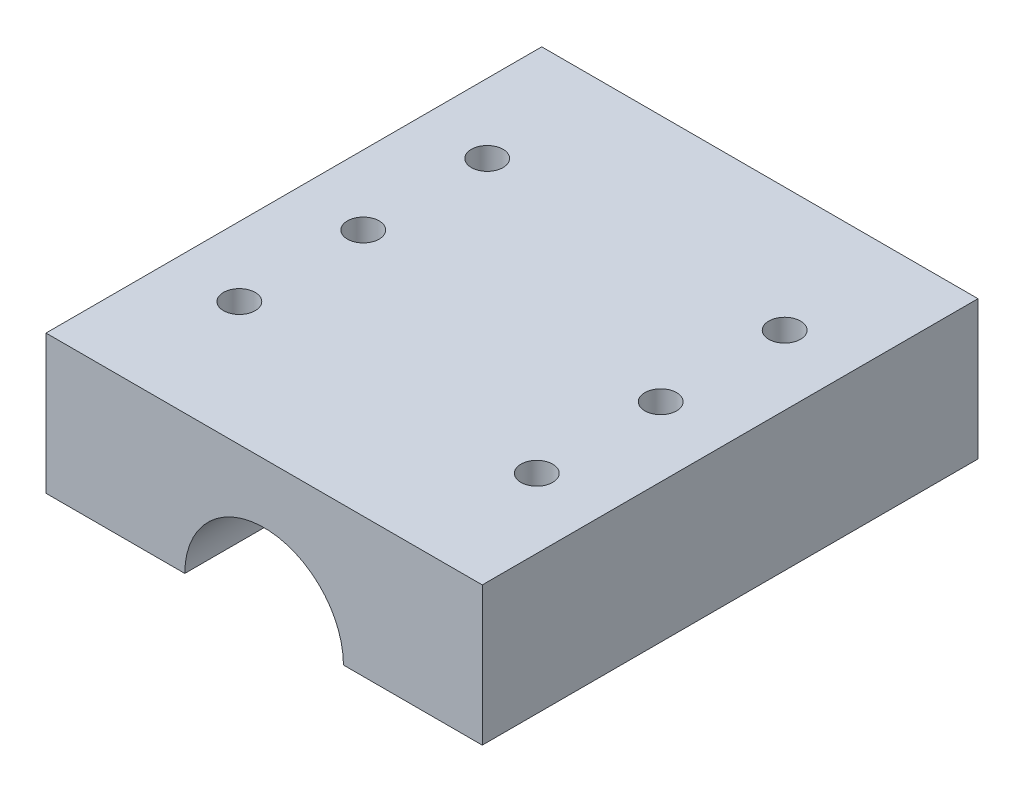
from build123d import *

# Parameters (mm, degrees)
Y_KSEKLIK_EKSTR_ZYON1_DEPTH = 50
IZIM2_R                     = 1.6
KES_EKSTR_ZYON1_DEPTH       = 57.391488719


with BuildPart() as part:
    # Çizim1 → Yükseklik-Ekstrüzyon1 (new body)
    with BuildSketch(Plane.XY):
        with BuildLine():
            Line((-8, 0), (-22, 0))
            Line((-22, 0), (-22, 14))
            Line((-22, 14), (22, 14))
            Line((22, 14), (22, 0))
            Line((22, 0), (8, 0))
            ThreePointArc((8, 0), (0, 8), (-8, 0))
        make_face()
    extrude(amount=-Y_KSEKLIK_EKSTR_ZYON1_DEPTH)

    # Çizim2 → Kes-Ekstrüzyon1 (cut, through all)
    with BuildSketch(Plane(origin=(0, 14, 0), x_dir=(1, 0, 0), z_dir=(0, 1, 0))):
        with Locations(Location((-15, 25, 0), (0, 0, 180))):
            Circle(IZIM2_R)
        with Locations(Location((-15, 37.5, 0), (0, 0, 180))):
            Circle(IZIM2_R)
        with Locations(Location((-15, 12.5, 0), (0, 0, 180))):
            Circle(IZIM2_R)
        with Locations((15, 12.5)):
            Circle(IZIM2_R)
        with Locations((15, 37.5)):
            Circle(IZIM2_R)
        with Locations((15, 25)):
            Circle(IZIM2_R)
    extrude(amount=-KES_EKSTR_ZYON1_DEPTH, mode=Mode.SUBTRACT)


solid = part.part
